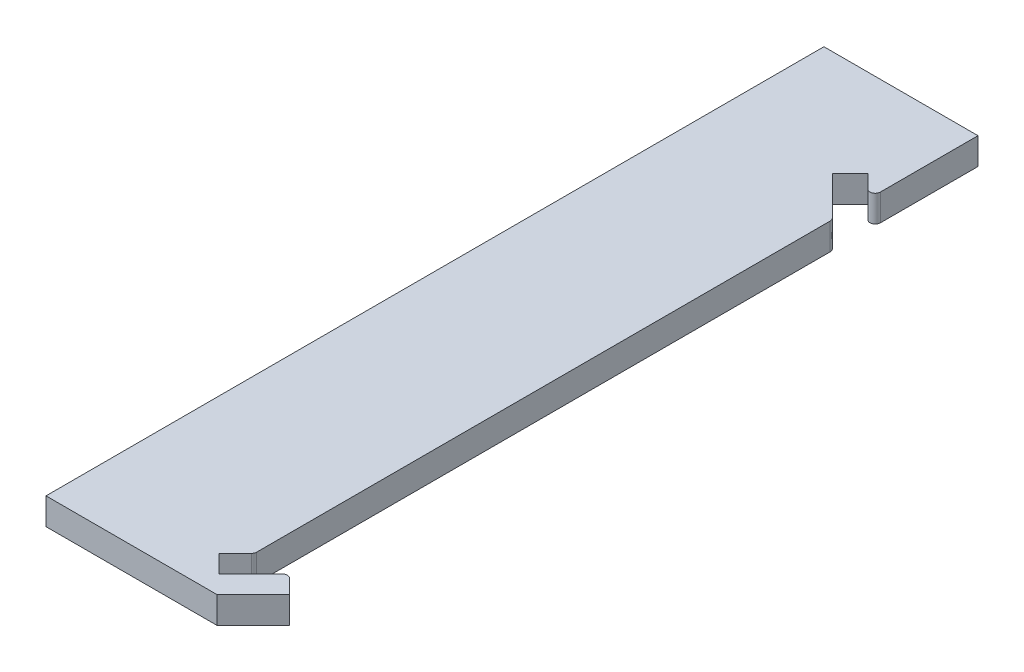
from build123d import *

# Parameters (mm, degrees)
SKETCH1_W           = 30
SKETCH1_H           = 160
BOSS_EXTRUDE1_DEPTH = 5.2
CUT_EXTRUDE1_DEPTH  = 10
FILLET1_R           = 1
BOSS_EXTRUDE2_DEPTH = 5.2
FILLET2_R           = 1


with BuildPart() as part:
    # Sketch1 → Boss-Extrude1 (new body)
    with BuildSketch(Plane(origin=(0, 0, 0), x_dir=(1, 0, 0), z_dir=(0, 1, 0))):
        with Locations((15, 80)):
            Rectangle(SKETCH1_W, SKETCH1_H)
    extrude(amount=BOSS_EXTRUDE1_DEPTH)

    # Sketch2 → Cut-Extrude1 (cut)
    with BuildSketch(Plane(origin=(0, 5.2, 0), x_dir=(1, 0, 0), z_dir=(0, 1, 0))):
        Polygon((30, 131.642135624), (22.221825407, 139.420310217), (25.686648635, 142.885133445), (30, 138.571782079), align=None)
        Polygon((30, 19.142135624), (19.393398282, 8.535533906), (0, 8.535533906), (0, 0), (30, 0), align=None)
    extrude(amount=-CUT_EXTRUDE1_DEPTH, mode=Mode.SUBTRACT)

    # Fillet1
    fillet1_edges = [part.edges().sort_by_distance(p)[0] for p in [
        (30, 2.6, -138.571782079),
        (30, 2.6, -131.642135624),
    ]]
    fillet(fillet1_edges, radius=FILLET1_R)

    # Sketch3 → Boss-Extrude2 (add)
    with BuildSketch(Plane(origin=(0, 5.2, 0), x_dir=(1, 0, 0), z_dir=(0, 1, 0))):
        Polygon((26.535176772, 15.677312396), (30, 12.212489168), (36.858935778, 19.071424946), (40.323759005, 15.606601718), (33.252691193, 8.535533906), (19.393398282, 8.535533906), align=None)
    extrude(amount=-BOSS_EXTRUDE2_DEPTH)

    # Fillet2
    fillet2_edges = [part.edges().sort_by_distance(p)[0] for p in [
        (30, 2.6, -19.142135624),
        (36.858935778, 2.6, -19.071424946),
    ]]
    fillet(fillet2_edges, radius=FILLET2_R)


solid = part.part
